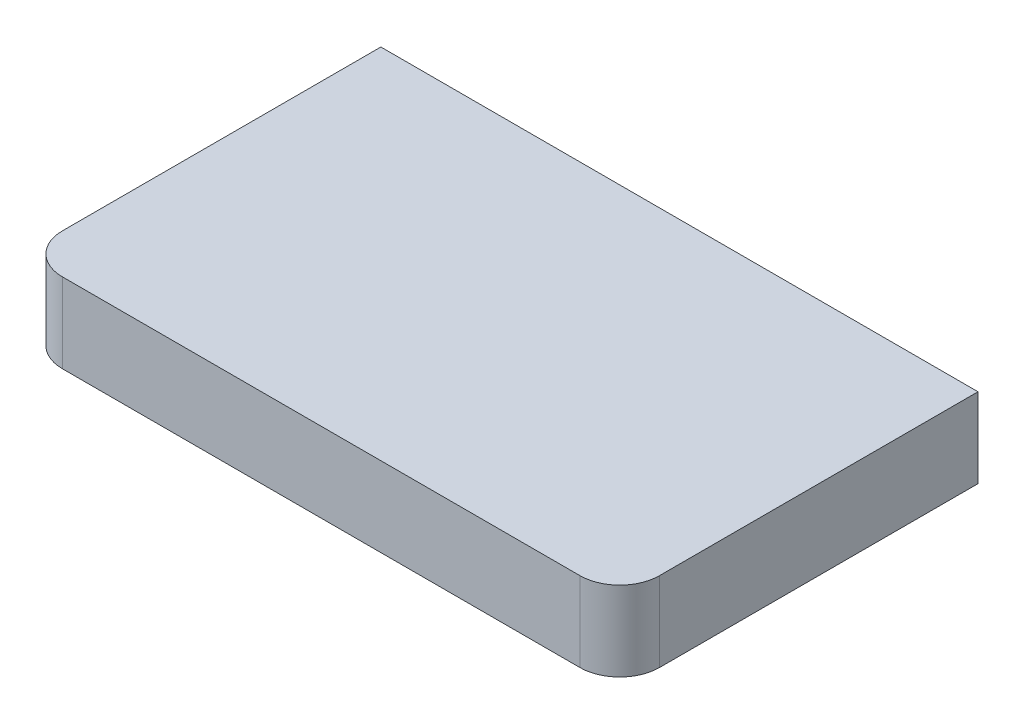
from build123d import *

# Parameters (mm, degrees)
SKETCH1_W               = 90
SKETCH1_H               = 20
BOSS_EXTRUDE1_DEPTH     = 150
CUT_EXTRUDE1_DEPTH      = 177.068168617
CUT_EXTRUDE1_DEPTH_BACK = 10
SKETCH2_R               = 15
CUT_EXTRUDE3_DEPTH      = 177.068168617
CUT_EXTRUDE3_DEPTH_BACK = 70
SKETCH4_R               = 5
FILLET1_R               = 10


with BuildPart() as part:
    # Sketch1 → Boss-Extrude1 (new body)
    with BuildSketch(Plane(origin=(0, 0, 0), x_dir=(0, 0, -1), z_dir=(1, 0, 0))):
        with Locations((-45, 10)):
            Rectangle(SKETCH1_W, SKETCH1_H)
    extrude(amount=-BOSS_EXTRUDE1_DEPTH)

    # Sketch2 → Cut-Extrude1 (cut, two sides: drawn at the far end of the back side and taken through both)
    with BuildSketch(Plane.XZ.offset(-CUT_EXTRUDE1_DEPTH_BACK)):
        with Locations(Location((-50, 62.75, 0), (0, 0, 90))):
            Circle(SKETCH2_R)
        with Locations(Location((-100, 62.75, 0), (0, 0, 90))):
            Circle(SKETCH2_R)
    extrude(amount=CUT_EXTRUDE1_DEPTH + CUT_EXTRUDE1_DEPTH_BACK, mode=Mode.SUBTRACT)

    # Sketch4 → Cut-Extrude3 (cut, two sides: drawn at the far end of the back side and taken through both)
    with BuildSketch(Plane(origin=(0, 0, 0), x_dir=(-1, 0, 0), z_dir=(0, 0, -1)).offset(-CUT_EXTRUDE3_DEPTH_BACK)):
        with Locations(Location((15, 10, 0), (0, 0, 180))):
            Circle(SKETCH4_R)
        with Locations(Location((75, 10, 0), (0, 0, 180))):
            Circle(SKETCH4_R)
        with Locations(Location((135, 10, 0), (0, 0, 180))):
            Circle(SKETCH4_R)
    extrude(amount=CUT_EXTRUDE3_DEPTH + CUT_EXTRUDE3_DEPTH_BACK, mode=Mode.SUBTRACT)

    # Fillet1
    fillet1_edges = [part.edges().sort_by_distance(p)[0] for p in [
        (-150, 10, 90),
        (0, 10, 90),
    ]]
    fillet(fillet1_edges, radius=FILLET1_R)


solid = part.part
